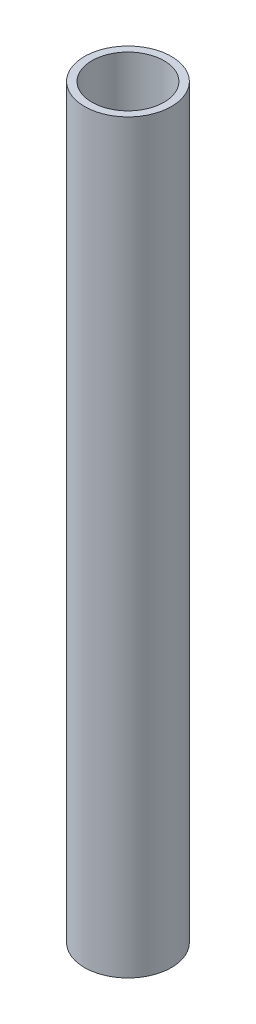
from build123d import *

# Parameters (mm, degrees)
SKETCH1_R           = 21.082
SKETCH1_R_2         = 17.5006
BOSS_EXTRUDE1_DEPTH = 361.95


with BuildPart() as part:
    # Sketch1 → Boss-Extrude1 (new body)
    with BuildSketch(Plane(origin=(0, 0, 0), x_dir=(1, 0, 0), z_dir=(0, 1, 0))):
        with Locations(Location((0, 0, 0), (0, 0, 270))):
            Circle(SKETCH1_R)
        with Locations(Location((0, 0, 0), (0, 0, 270))):
            Circle(SKETCH1_R_2, mode=Mode.SUBTRACT)
    extrude(amount=BOSS_EXTRUDE1_DEPTH)


solid = part.part
